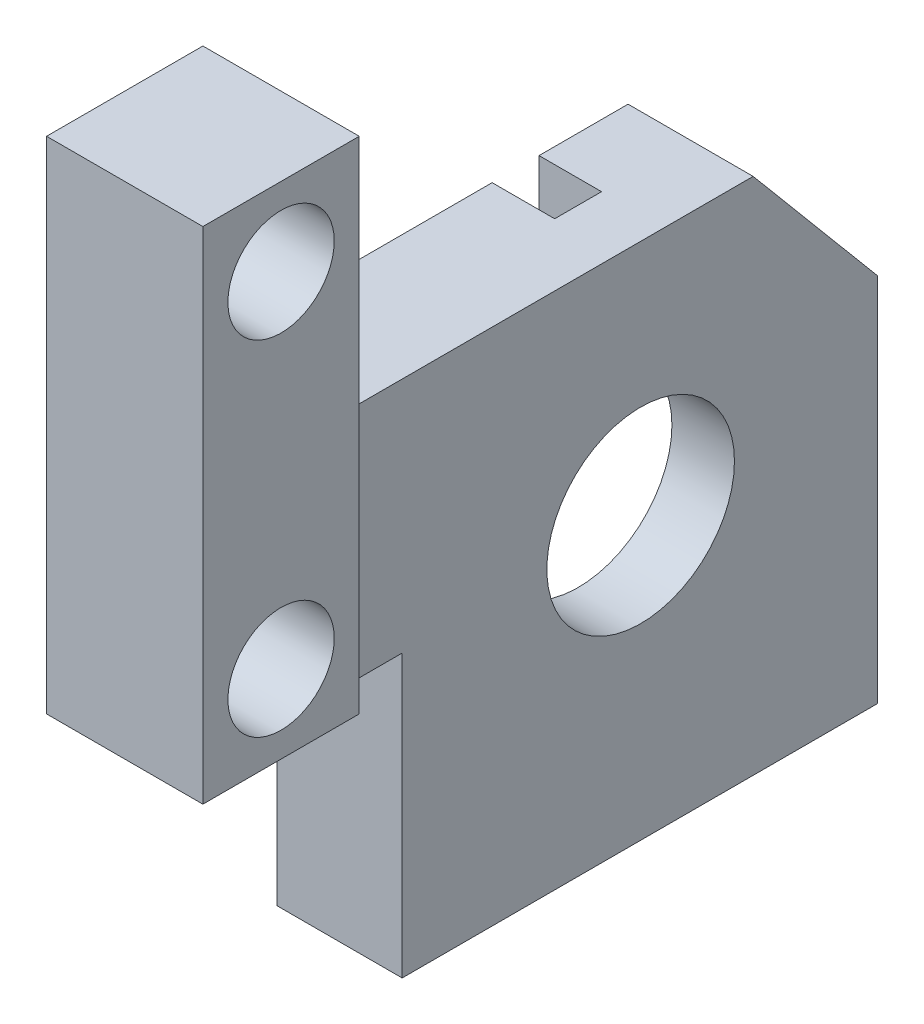
from build123d import *

# Parameters (mm, degrees)
BOSS_EXTRUDE1_DEPTH = 2
BOSS_EXTRUDE2_DEPTH = 2
SKETCH3_R           = 3
CUT_EXTRUDE1_DEPTH  = 2
SKETCH4_R           = 1.7
BOSS_EXTRUDE3_DEPTH = 5
CUT_EXTRUDE2_DEPTH  = 1


with BuildPart() as part:
    # Sketch2 → Boss-Extrude1 (new body)
    with BuildSketch(Plane(origin=(0, 0, 0), x_dir=(0, 0, -1), z_dir=(1, 0, 0))):
        Polygon((-8.109308511, -7.091340238), (-8.109308511, 4.696600231), (-4.079902129, 9.498659762), (3.11566899, 9.498659762), (7.090691489, 4.761412419), (7.090691489, -7.091340238), align=None)
    extrude(amount=-BOSS_EXTRUDE1_DEPTH)

    # Sketch1 → Boss-Extrude2 (add)
    with BuildSketch(Plane(origin=(0, 0, 0), x_dir=(0, 0, -1), z_dir=(1, 0, 0))):
        Polygon((-6.109308511, 3.968659762), (-3.147286813, 7.498659762), (-1.232116569, 7.498659762), (-1.232116569, 9.498659762), (-4.079902129, 9.498659762), (-8.109308511, 4.696600231), (-8.109308511, -7.091340238), (-3.982116569, -7.091340238), (-3.982116569, -5.091340238), (-6.109308511, -5.091340238), align=None)
        Polygon((5.090691489, 4.03347195), (5.090691489, -5.091340238), (3.017883431, -5.091340238), (3.017883431, -7.091340238), (7.090691489, -7.091340238), (7.090691489, 4.761412419), (3.11566899, 9.498659762), (0.267883431, 9.498659762), (0.267883431, 7.498659762), (2.183053674, 7.498659762), align=None)
    extrude(amount=BOSS_EXTRUDE2_DEPTH)

    # Sketch3 → Cut-Extrude1 (cut)
    with BuildSketch(Plane(origin=(0, 0, 0), x_dir=(0, 0, -1), z_dir=(1, 0, 0))):
        with Locations((-0.482116569, 1.908659762)):
            Circle(SKETCH3_R)
    extrude(amount=-CUT_EXTRUDE1_DEPTH, mode=Mode.SUBTRACT)

    # Sketch4 → Boss-Extrude3 (add)
    with BuildSketch(Plane(origin=(2, 0, 0), x_dir=(0, 0, -1), z_dir=(1, 0, 0))):
        Polygon((-15.482116569, 1.908659762), (-8.109308511, 1.908659762), (-8.109308511, 4.696600231), (-4.079902129, 9.498659762), (-10.482116569, 9.498659762), (-10.482116569, 17.908659762), (-15.482116569, 17.908659762), align=None)
        with Locations((-12.982116569, 4.408659762)):
            Circle(SKETCH4_R, mode=Mode.SUBTRACT)
        with Locations((-12.982116569, 15.408659762)):
            Circle(SKETCH4_R, mode=Mode.SUBTRACT)
    extrude(amount=-BOSS_EXTRUDE3_DEPTH)

    # Sketch5 → Cut-Extrude2 (cut)
    with BuildSketch(Plane.ZY.offset(3)):
        Polygon((10.482116569, 9.498659762), (10.482116569, 1.908659762), (8.109308511, 1.908659762), (8.109308511, 4.696600231), (4.079902129, 9.498659762), align=None)
    extrude(amount=-CUT_EXTRUDE2_DEPTH, mode=Mode.SUBTRACT)


with BuildPart() as body_2:
    # Mirror2: mirrored copy
    add(part.part.mirror(Plane(origin=(10, 0, 0), x_dir=(0, 0, 1), z_dir=(1, 0, 0))))


solid = body_2.part
